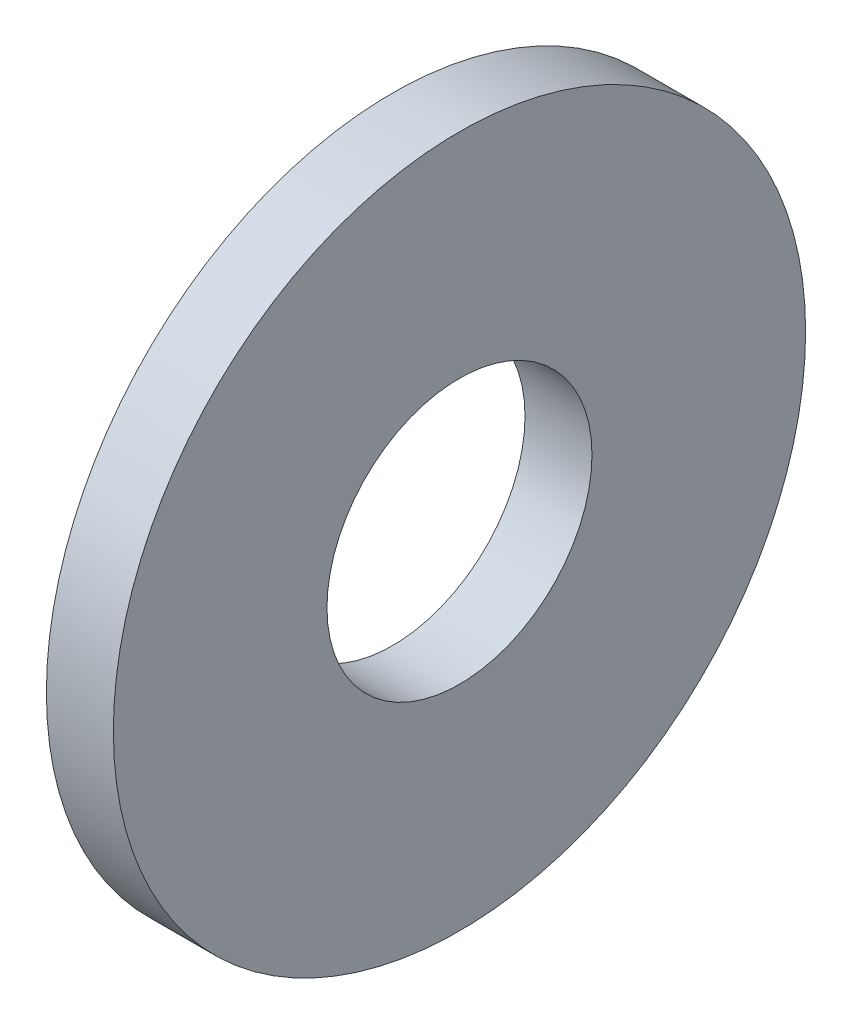
from build123d import *

# Parameters (mm, degrees)
SKETCH1_R           = 9.3218
SKETCH1_R_2         = 3.5687
BOSS_EXTRUDE1_DEPTH = 1.8034


with BuildPart() as part:
    # Sketch1 → Boss-Extrude1 (new body)
    with BuildSketch(Plane(origin=(0, 0, 0), x_dir=(0, 0, -1), z_dir=(1, 0, 0))):
        Circle(SKETCH1_R)
        Circle(SKETCH1_R_2, mode=Mode.SUBTRACT)
    extrude(amount=BOSS_EXTRUDE1_DEPTH)


solid = part.part
